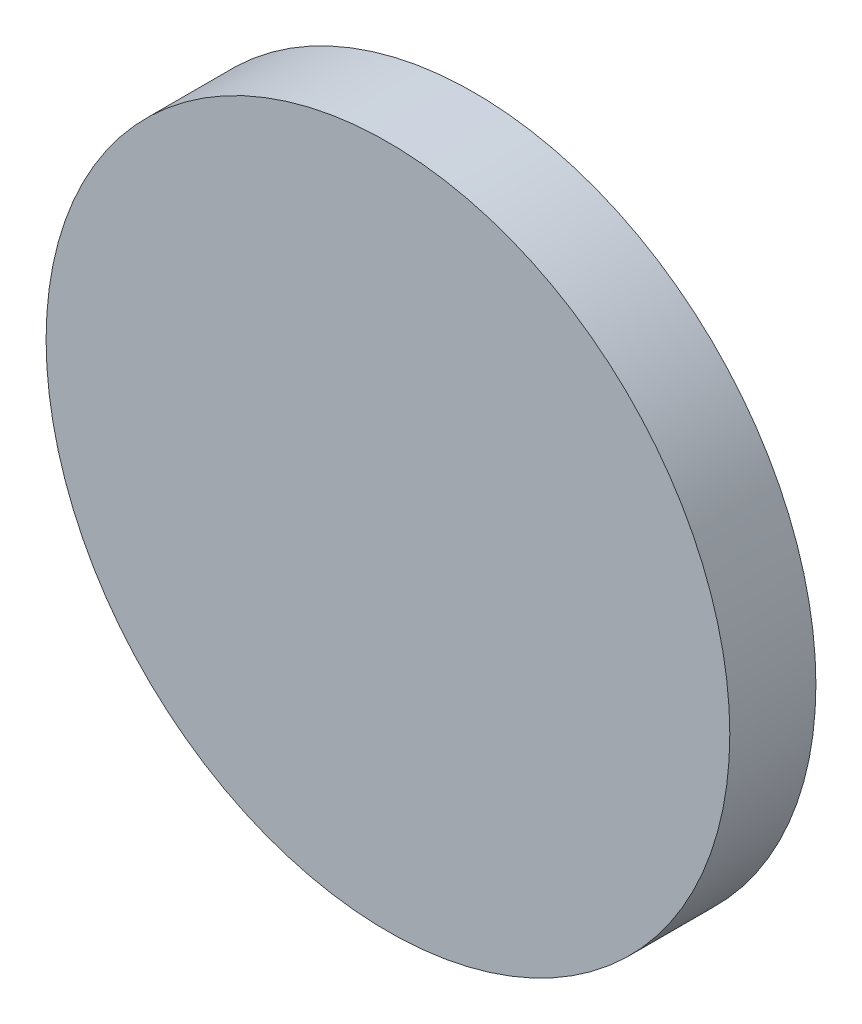
from build123d import *

# Parameters (mm, degrees)
SKETCH1_R           = 13.5
BOSS_EXTRUDE1_DEPTH = 3.4
SKETCH2_R           = 13
CUT_EXTRUDE1_DEPTH  = 2.4


with BuildPart() as part:
    # Sketch1 → Boss-Extrude1 (new body)
    with BuildSketch(Plane.XY):
        Circle(SKETCH1_R)
    extrude(amount=BOSS_EXTRUDE1_DEPTH)

    # Sketch2 → Cut-Extrude1 (cut)
    with BuildSketch(Plane(origin=(0, 0, 0), x_dir=(-1, 0, 0), z_dir=(0, 0, -1))):
        Circle(SKETCH2_R)
    extrude(amount=-CUT_EXTRUDE1_DEPTH, mode=Mode.SUBTRACT)


solid = part.part
